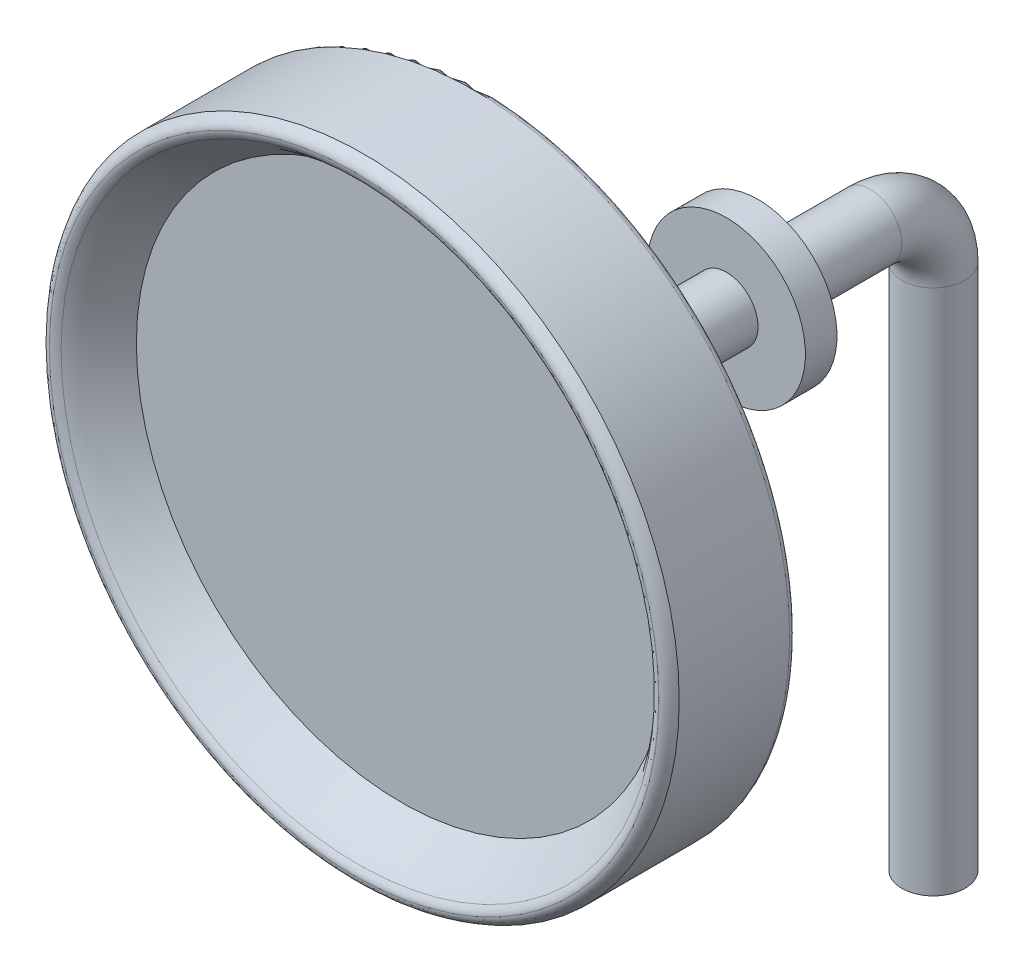
from build123d import *

# Parameters (mm, degrees)
SKETCH2_R            = 17.5
BOSS_EXTRUDE1_DEPTH  = 2
SKETCH4_R            = 7.5
BOSS_EXTRUDE2_DEPTH  = 5
SKETCH5_R            = 5
BOSS_EXTRUDE3_DEPTH  = 3
SKETCH6_R            = 7.5
BOSS_EXTRUDE4_DEPTH  = 3
SKETCH7_R            = 5
BOSS_EXTRUDE5_DEPTH  = 3
SKETCH8_R            = 7.5
BOSS_EXTRUDE6_DEPTH  = 3
SKETCH9_R            = 5
BOSS_EXTRUDE7_DEPTH  = 3
SKETCH10_R           = 7.5
BOSS_EXTRUDE8_DEPTH  = 5
SKETCH11_R           = 5
BOSS_EXTRUDE9_DEPTH  = 12
SKETCH12_R           = 12.5
BOSS_EXTRUDE10_DEPTH = 5
SKETCH13_R           = 5
BOSS_EXTRUDE11_DEPTH = 150
SKETCH15_W           = 126.965595496
SKETCH15_H           = 152.993542573
CUT_EXTRUDE1_DEPTH   = 84
SKETCH16_R           = 5


with BuildPart() as part:
    # Sketch1 → Revolve1 (revolve)
    with BuildSketch(Plane(origin=(0, 0, 0), x_dir=(0, 0, -1), z_dir=(1, 0, 0)), mode=Mode.PRIVATE) as revolve1_sk:
        with BuildLine():
            Line((7.5, 42), (7.5, 0))
            Line((7.5, 0), (20, 0))
            Line((20, 0), (20, 49))
            ThreePointArc((20, 49), (19.707106781, 49.707106781), (19, 50))
            Line((19, 50), (1.508773395, 50))
            add(Edge.make_bspline(
                [(1.508773395, 50), (0.432324338, 49.451358887), (0.008310505, 48.873891546), (0, 48.293227533)],
                knots=[0, 0, 0, 0, 0.135349479, 0.135349479, 0.135349479, 0.135349479], degree=3))
            Line((0, 48.293227533), (0, 48.258265787))
            add(Edge.make_bspline(
                [(0, 48.258265787), (0.016256181, 47.11783752), (3.565780066, 44.566166731), (6.093568686, 42.91770881), (7.5, 42)],
                knots=[0.138065657, 0.138065657, 0.138065657, 0.138065657, 0.403839001, 0.727380334, 0.727380334, 0.727380334, 0.727380334], degree=3))
        make_face()
    revolve(revolve1_sk.sketch.rotate(Axis((0, 0, 0), (0, 0, -1)), 270), axis=Axis((0, 0, 0), (0, 0, -1)))

    # Sketch2 → Boss-Extrude1 (add)
    with BuildSketch(Plane(origin=(0, 0, -20), x_dir=(-1, 0, 0), z_dir=(0, 0, -1))):
        Circle(SKETCH2_R)
    extrude(amount=BOSS_EXTRUDE1_DEPTH)


with BuildPart() as body_2:
    # Sketch4 → Boss-Extrude2 (new body)
    with BuildSketch(Plane(origin=(0, 0, -22), x_dir=(-1, 0, 0), z_dir=(0, 0, -1))):
        Circle(SKETCH4_R)
    extrude(amount=BOSS_EXTRUDE2_DEPTH)

    # Sketch5 → Boss-Extrude3 (add)
    with BuildSketch(Plane(origin=(0, 0, -27), x_dir=(-1, 0, 0), z_dir=(0, 0, -1))):
        Circle(SKETCH5_R)
    extrude(amount=BOSS_EXTRUDE3_DEPTH)


with BuildPart() as body_3:
    # Sketch6 → Boss-Extrude4 (new body)
    with BuildSketch(Plane(origin=(0, 0, -30), x_dir=(-1, 0, 0), z_dir=(0, 0, -1))):
        Circle(SKETCH6_R)
    extrude(amount=BOSS_EXTRUDE4_DEPTH)


with BuildPart() as body_4:
    # Sketch7 → Boss-Extrude5 (new body)
    with BuildSketch(Plane(origin=(0, 0, -33), x_dir=(-1, 0, 0), z_dir=(0, 0, -1))):
        Circle(SKETCH7_R)
    extrude(amount=BOSS_EXTRUDE5_DEPTH)

    # Sketch8 → Boss-Extrude6 (add)
    with BuildSketch(Plane(origin=(0, 0, -36), x_dir=(-1, 0, 0), z_dir=(0, 0, -1))):
        Circle(SKETCH8_R)
    extrude(amount=BOSS_EXTRUDE6_DEPTH)


with BuildPart() as body_5:
    # Sketch9 → Boss-Extrude7 (new body)
    with BuildSketch(Plane(origin=(0, 0, -39), x_dir=(-1, 0, 0), z_dir=(0, 0, -1))):
        Circle(SKETCH9_R)
    extrude(amount=BOSS_EXTRUDE7_DEPTH)

    # Sketch10 → Boss-Extrude8 (add)
    with BuildSketch(Plane(origin=(0, 0, -42), x_dir=(-1, 0, 0), z_dir=(0, 0, -1))):
        Circle(SKETCH10_R)
    extrude(amount=BOSS_EXTRUDE8_DEPTH)


with BuildPart() as body_6:
    # Sketch11 → Boss-Extrude9 (new body)
    with BuildSketch(Plane(origin=(0, 0, -47), x_dir=(-1, 0, 0), z_dir=(0, 0, -1))):
        Circle(SKETCH11_R)
    extrude(amount=BOSS_EXTRUDE9_DEPTH)


with BuildPart() as body_7:
    # Sketch12 → Boss-Extrude10 (new body)
    with BuildSketch(Plane(origin=(0, 0, -59), x_dir=(-1, 0, 0), z_dir=(0, 0, -1))):
        Circle(SKETCH12_R)
    extrude(amount=BOSS_EXTRUDE10_DEPTH)


with BuildPart() as body_8:
    # Sketch13 → Boss-Extrude11 (new body)
    with BuildSketch(Plane(origin=(0, 0, -64), x_dir=(-1, 0, 0), z_dir=(0, 0, -1))):
        Circle(SKETCH13_R)
    extrude(amount=BOSS_EXTRUDE11_DEPTH)

    # Sketch15 → Cut-Extrude1 (cut, symmetric)
    with BuildSketch(Plane(origin=(0, 0, 0), x_dir=(1, 0, 0), z_dir=(0, 1, 0))):
        with Locations((-3.174139887, 154.9295123)):
            Rectangle(SKETCH15_W, SKETCH15_H)
    extrude(amount=CUT_EXTRUDE1_DEPTH, both=True, mode=Mode.SUBTRACT)

    # Sweep1: sweep along a path in Sketch17
    with BuildLine(Plane(origin=(0, 0, 0), x_dir=(0, 0, -1), z_dir=(1, 0, 0))) as sweep1_path:
        Line((78.432741013, 0), (81.773609231, 0))
        ThreePointArc((81.773609231, 0), (88.844677043, -2.928932188), (91.773609231, -10))
        Line((91.773609231, -10), (91.773609231, -93.417748551))
    # Sketch16 → Sweep1 (sweep)
    with BuildSketch(Plane(origin=(0, 0, -78.432741013), x_dir=(-1, 0, 0), z_dir=(0, 0, -1))):
        Circle(SKETCH16_R)
    sweep(path=sweep1_path.line)


solid = Compound([part.part, body_2.part, body_3.part, body_4.part, body_5.part, body_6.part, body_7.part, body_8.part])
